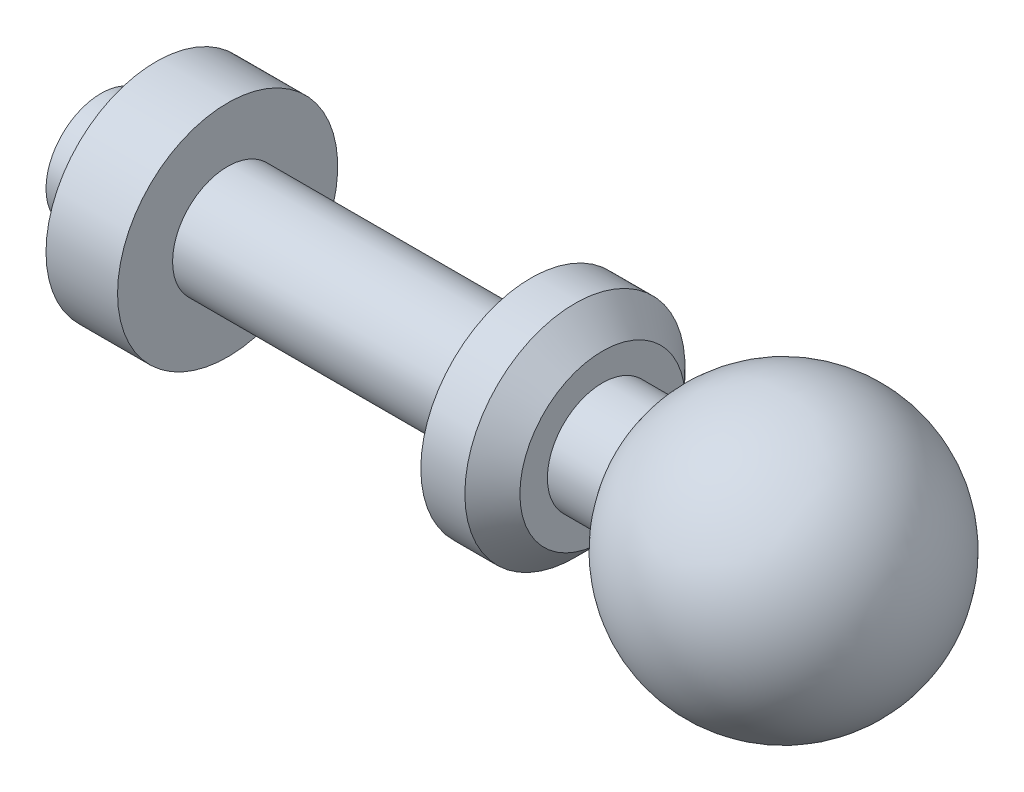
from build123d import *


with BuildPart() as part:
    # Sketch1 → Revolve1 (revolve)
    with BuildSketch(Plane.XY, mode=Mode.PRIVATE) as revolve1_sk:
        with BuildLine():
            Line((0, 0), (0, 10))
            Line((0, 10), (10, 10))
            Line((10, 10), (10, 20))
            Line((10, 20), (23, 20))
            Line((23, 20), (23, 10))
            Line((23, 10), (78.1, 10))
            Line((78.1, 10), (78.1, 20))
            Line((78.1, 20), (86.1, 20))
            Line((86.1, 20), (91.1, 15))
            Line((91.1, 15), (91.1, 10))
            Line((91.1, 10), (101.1, 10))
            ThreePointArc((101.1, 10), (129.120619567, 24.472657823), (149.012878475, 0))
            Line((149.012878475, 0), (0, 0))
        make_face()
    revolve(revolve1_sk.sketch.rotate(Axis((0, 0, 0), (1, 0, 0)), 90), axis=Axis((0, 0, 0), (1, 0, 0)))


solid = part.part
